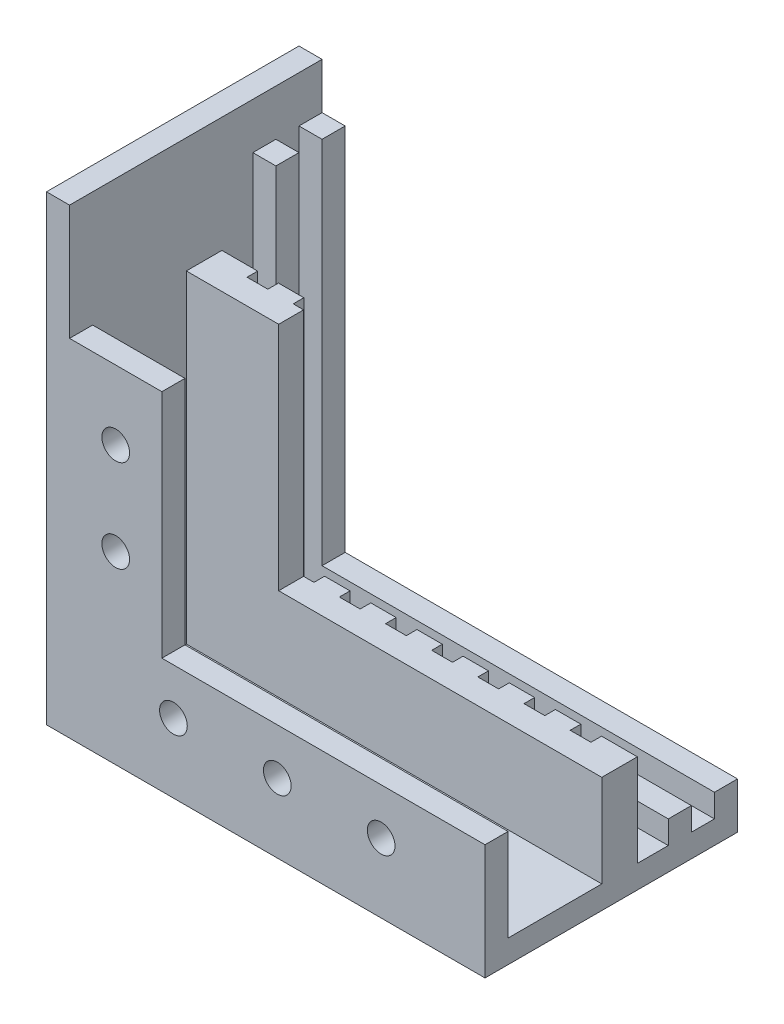
from build123d import *

# Parameters (mm, degrees)
SKETCH1_W              = 90
SKETCH1_H              = 30.3
BOSS_EXTRUDE1_DEPTH    = 25
SKETCH2_W              = 90
SKETCH2_H              = 20.3
F_2020_SLOT_20_3_DEPTH = 20
SKETCH3_R              = 3
CUT_EXTRUDE2_DEPTH     = 99.19923625
SKETCH5_W              = 90
SKETCH5_H              = 5
BOSS_EXTRUDE2_DEPTH    = 9.4
SKETCH6_W              = 90
SKETCH6_H              = 10
BOSS_EXTRUDE3_DEPTH    = 5
SKETCH7_R              = 3
CUT_EXTRUDE4_DEPTH     = 5
LPATTERN1_COUNT        = 3
LPATTERN1_PITCH        = 22.5
LPATTERN2_COUNT        = 3
LPATTERN2_PITCH        = 22.5
SKETCH10_W             = 90
SKETCH10_H             = 20
BOSS_EXTRUDE4_DEPTH    = 2.7
SKETCH11_W             = 4.5
SKETCH11_H             = 20
CUT_EXTRUDE5_DEPTH     = 2.3
LPATTERN3_COUNT        = 8
LPATTERN3_PITCH        = 10
SKETCH12_W             = 90
SKETCH12_H             = 5
DIFFUSER_SLOT_DEPTH    = 5
SKETCH13_W             = 90
SKETCH13_H             = 10
BOSS_EXTRUDE6_DEPTH    = 5
SKETCH14_W             = 54.7
SKETCH14_H             = 100
BOSS_EXTRUDE7_DEPTH    = 5
SKETCH15_W             = 7.7
SKETCH15_H             = 60
SKETCH15_W_2           = 5
BOSS_EXTRUDE8_DEPTH    = 20
SKETCH16_W             = 5
SKETCH16_H             = 75
BOSS_EXTRUDE9_DEPTH    = 5
SKETCH17_W             = 20
SKETCH17_H             = 25
CUT_EXTRUDE6_DEPTH     = 35
SKETCH18_W             = 4.5
SKETCH18_H             = 50
SKETCH18_W_2           = 2.25
CUT_EXTRUDE7_DEPTH     = 2.3
SKETCH19_W             = 5
SKETCH19_H             = 5
BOSS_EXTRUDE10_DEPTH   = 5
SKETCH20_R             = 3
CUT_EXTRUDE8_DEPTH     = 5
SKETCH22_R             = 3
CUT_EXTRUDE9_DEPTH     = 5


with BuildPart() as part:
    # Sketch1 → Boss-Extrude1 (new body)
    with BuildSketch(Plane(origin=(0, 0, 0), x_dir=(1, 0, 0), z_dir=(0, 1, 0))):
        with Locations((45, -15.15)):
            Rectangle(SKETCH1_W, SKETCH1_H)
    extrude(amount=BOSS_EXTRUDE1_DEPTH)

    # Sketch2 → 2020_Slot_20.3 (cut)
    with BuildSketch(Plane(origin=(0, 25, 0), x_dir=(1, 0, 0), z_dir=(0, 1, 0))):
        with Locations((45, -15.15)):
            Rectangle(SKETCH2_W, SKETCH2_H)
    extrude(amount=-F_2020_SLOT_20_3_DEPTH, mode=Mode.SUBTRACT)

    # Sketch3 → Cut-Extrude2 (cut, through all)
    with BuildSketch(Plane(origin=(0, 0, 0), x_dir=(-1, 0, 0), z_dir=(0, -1, 0))):
        with Locations(Location((-22.5, -15, 0), (0, 0, 90))):
            Circle(SKETCH3_R)
    cut_extrude2 = extrude(amount=-CUT_EXTRUDE2_DEPTH, mode=Mode.SUBTRACT)

    # Sketch5 → Boss-Extrude2 (add)
    with BuildSketch(Plane(origin=(0, 0, 0), x_dir=(-1, 0, 0), z_dir=(0, 0, -1))):
        with Locations((-45, 2.5)):
            Rectangle(SKETCH5_W, SKETCH5_H)
    extrude(amount=BOSS_EXTRUDE2_DEPTH)

    # Sketch6 → Boss-Extrude3 (add)
    with BuildSketch(Plane(origin=(0, 0, -9.4), x_dir=(-1, 0, 0), z_dir=(0, 0, -1))):
        with Locations((-45, 5)):
            Rectangle(SKETCH6_W, SKETCH6_H)
    extrude(amount=BOSS_EXTRUDE3_DEPTH)

    # Sketch7 → Cut-Extrude4 (cut)
    with BuildSketch(Plane.XY.offset(30.3)):
        with Locations((22.5, 15)):
            Circle(SKETCH7_R)
    cut_extrude4 = extrude(amount=-CUT_EXTRUDE4_DEPTH, mode=Mode.SUBTRACT)

    # LPattern1: Cut-Extrude4 ×3
    with Locations(*[(i * LPATTERN1_PITCH, 0, 0) for i in range(1, LPATTERN1_COUNT)]):
        add(cut_extrude4, mode=Mode.SUBTRACT)

    # LPattern2: Cut-Extrude2 ×3
    with Locations(*[(i * LPATTERN2_PITCH, 0, 0) for i in range(1, LPATTERN2_COUNT)]):
        add(cut_extrude2, mode=Mode.SUBTRACT)

    # Sketch10 → Boss-Extrude4 (add)
    with BuildSketch(Plane(origin=(0, 0, 0), x_dir=(-1, 0, 0), z_dir=(0, 0, -1))):
        with Locations((-45, 15)):
            Rectangle(SKETCH10_W, SKETCH10_H)
    extrude(amount=BOSS_EXTRUDE4_DEPTH)

    # Sketch11 → Cut-Extrude5 (cut)
    with BuildSketch(Plane(origin=(0, 0, -2.7), x_dir=(-1, 0, 0), z_dir=(0, 0, -1))):
        with Locations((-10, 15)):
            Rectangle(SKETCH11_W, SKETCH11_H)
    cut_extrude5 = extrude(amount=-CUT_EXTRUDE5_DEPTH, mode=Mode.SUBTRACT)

    # LPattern3: Cut-Extrude5 ×8
    with Locations(*[(i * LPATTERN3_PITCH, 0, 0) for i in range(1, LPATTERN3_COUNT)]):
        add(cut_extrude5, mode=Mode.SUBTRACT)

    # Sketch12 → Diffuser_Slot (add)
    with BuildSketch(Plane(origin=(0, 0, -14.4), x_dir=(-1, 0, 0), z_dir=(0, 0, -1))):
        with Locations((-45, 2.5)):
            Rectangle(SKETCH12_W, SKETCH12_H)
    extrude(amount=DIFFUSER_SLOT_DEPTH)

    # Sketch13 → Boss-Extrude6 (add)
    with BuildSketch(Plane(origin=(0, 0, -19.4), x_dir=(-1, 0, 0), z_dir=(0, 0, -1))):
        with Locations((-45, 5)):
            Rectangle(SKETCH13_W, SKETCH13_H)
    extrude(amount=BOSS_EXTRUDE6_DEPTH)

    # Sketch14 → Boss-Extrude7 (add)
    with BuildSketch(Plane.ZY):
        with Locations((2.95, 50)):
            Rectangle(SKETCH14_W, SKETCH14_H)
    extrude(amount=BOSS_EXTRUDE7_DEPTH)

    # Sketch15 → Boss-Extrude8 (add)
    with BuildSketch(Plane(origin=(0, 0, 0), x_dir=(0, 0, -1), z_dir=(1, 0, 0))):
        with Locations((-1.15, 55)):
            Rectangle(SKETCH15_W, SKETCH15_H)
        with Locations((-27.8, 55)):
            Rectangle(SKETCH15_W_2, SKETCH15_H)
    extrude(amount=BOSS_EXTRUDE8_DEPTH)

    # Sketch16 → Boss-Extrude9 (add)
    with BuildSketch(Plane(origin=(0, 0, 0), x_dir=(0, 0, -1), z_dir=(1, 0, 0))):
        with Locations((11.9, 47.5)):
            Rectangle(SKETCH16_W, SKETCH16_H)
        with Locations((21.9, 47.5)):
            Rectangle(SKETCH16_W, SKETCH16_H)
    extrude(amount=BOSS_EXTRUDE9_DEPTH)

    # Sketch17 → Cut-Extrude6 (cut)
    with BuildSketch(Plane.XY.offset(30.3)):
        with Locations((10, 87.5)):
            Rectangle(SKETCH17_W, SKETCH17_H)
    extrude(amount=-CUT_EXTRUDE6_DEPTH, mode=Mode.SUBTRACT)

    # Sketch18 → Cut-Extrude7 (cut)
    with BuildSketch(Plane(origin=(0, 0, -2.7), x_dir=(-1, 0, 0), z_dir=(0, 0, -1))):
        with Locations((-10, 50)):
            Rectangle(SKETCH18_W, SKETCH18_H)
        with Locations((-18.875, 50)):
            Rectangle(SKETCH18_W_2, SKETCH18_H)
    extrude(amount=-CUT_EXTRUDE7_DEPTH, mode=Mode.SUBTRACT)

    # Sketch19 → Boss-Extrude10 (add)
    with BuildSketch(Plane(origin=(0, 85, 0), x_dir=(1, 0, 0), z_dir=(0, 1, 0))):
        with Locations((2.5, 21.9)):
            Rectangle(SKETCH19_W, SKETCH19_H)
        with Locations((2.5, 11.9)):
            Rectangle(SKETCH19_W, SKETCH19_H)
    extrude(amount=BOSS_EXTRUDE10_DEPTH)

    # Sketch20 → Cut-Extrude8 (cut)
    with BuildSketch(Plane.XY.offset(30.3)):
        with Locations((10, 60)):
            Circle(SKETCH20_R)
        with Locations((10, 40)):
            Circle(SKETCH20_R)
    extrude(amount=-CUT_EXTRUDE8_DEPTH, mode=Mode.SUBTRACT)

    # Sketch22 → Cut-Extrude9 (cut)
    with BuildSketch(Plane.ZY.offset(5)):
        with Locations((15.3, 60)):
            Circle(SKETCH22_R)
        with Locations((15.3, 40.043901833)):
            Circle(SKETCH22_R)
    extrude(amount=-CUT_EXTRUDE9_DEPTH, mode=Mode.SUBTRACT)


solid = part.part
